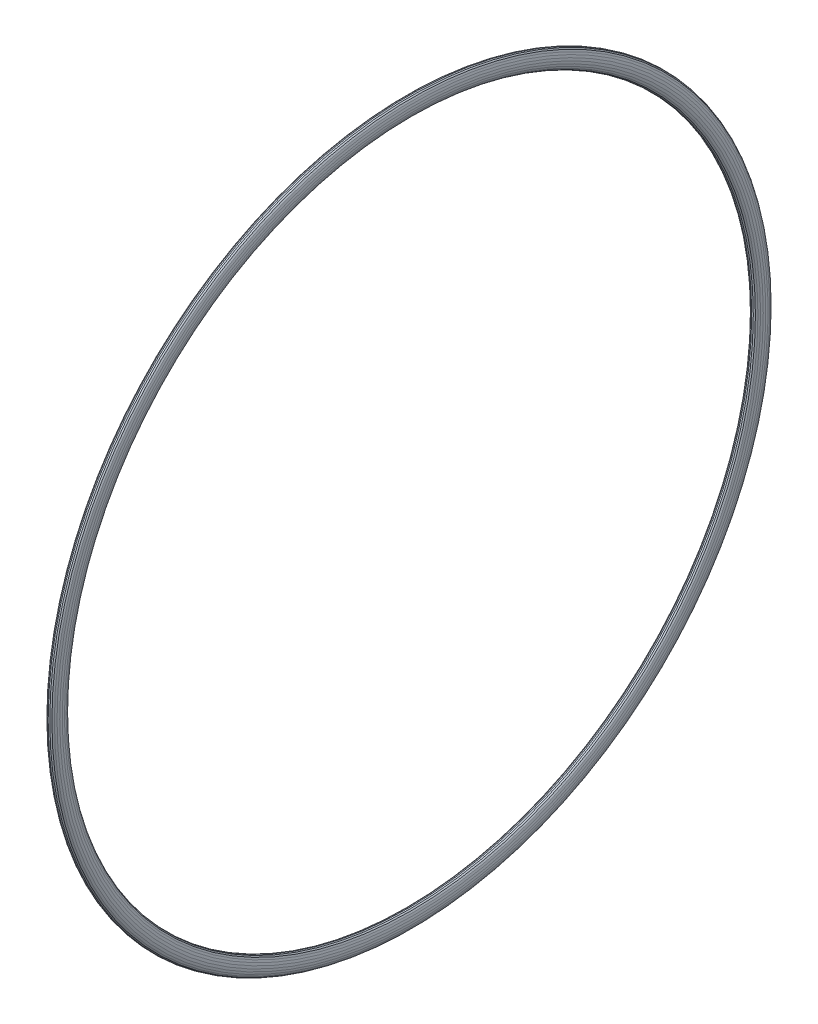
from build123d import *


with BuildPart() as part:
    # O_Ring_Outer Sketch → O_Ring_Outer (revolve)
    with BuildSketch(Plane.XY):
        Polygon((-1.955, 68.28), (-1.921777681, 68.735548065), (-1.824374769, 69.160051282), (-1.669429112, 69.524580459), (-1.4675, 69.804293534), (-1.232348569, 69.980128524), (-0.98, 70.040102564), (-0.727651431, 69.980128524), (-0.4925, 69.804293534), (-0.290570888, 69.524580459), (-0.135625231, 69.160051282), (-0.038222319, 68.735548065), (-0.005, 68.28), (-0.038222319, 67.824451935), (-0.135625231, 67.399948718), (-0.290570888, 67.035419541), (-0.4925, 66.755706466), (-0.727651431, 66.579871476), (-0.98, 66.519897436), (-1.232348569, 66.579871476), (-1.4675, 66.755706466), (-1.669429112, 67.035419541), (-1.824374769, 67.399948718), (-1.921777681, 67.824451935), align=None)
    revolve(axis=Axis((-1000, 0, 0), (1, 0, 0)))


solid = part.part
